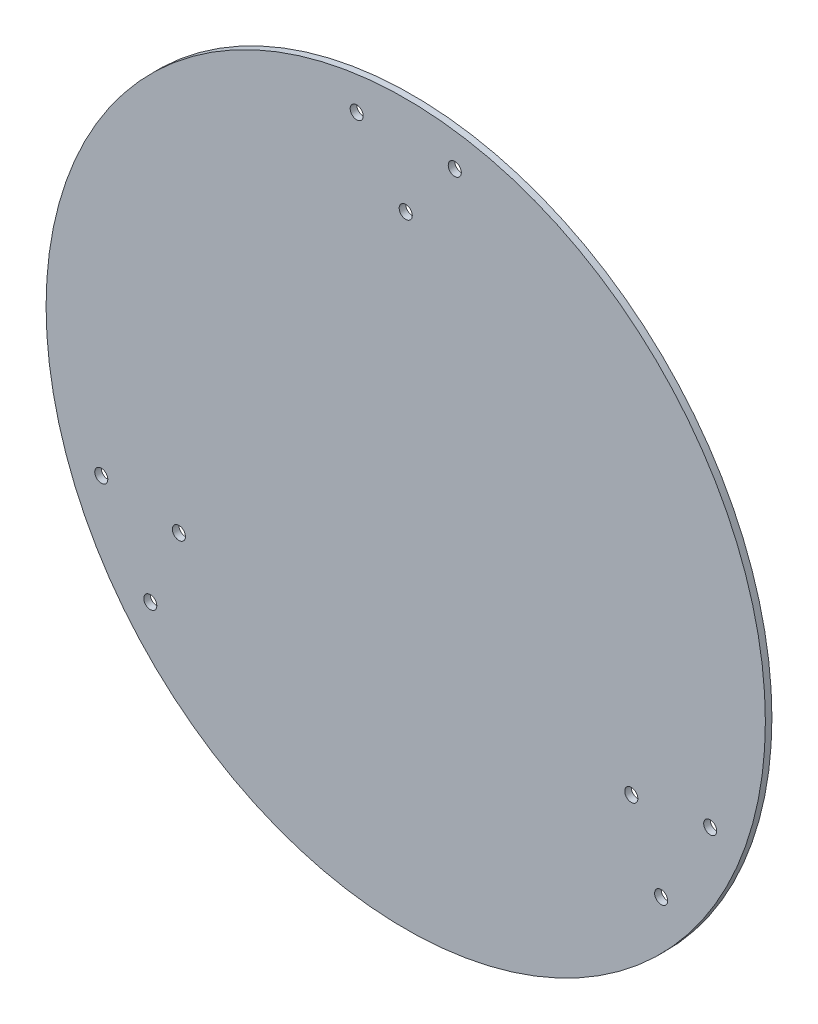
from build123d import *

# Parameters (mm, degrees)
ESQUISSE2_R             = 110
BOSS_EXTRU_1_DEPTH      = 2
ESQUISSE7_R             = 2
ESQUISSE7_R_2           = 1.991144914
ENL_V_MAT_EXTRU_7_DEPTH = 2


with BuildPart() as part:
    # Esquisse2 → Boss.-Extru.1 (new body)
    with BuildSketch(Plane.XY):
        Circle(ESQUISSE2_R)
    extrude(amount=BOSS_EXTRU_1_DEPTH)

    # Esquisse7 → Enlèv. mat.-Extru.7 (cut)
    with BuildSketch(Plane(origin=(0, 0, 0), x_dir=(-1, 0, 0), z_dir=(0, 0, -1))):
        with Locations((-15, 98.868599666)):
            Circle(ESQUISSE7_R)
        with Locations((15, 98.868599666)):
            Circle(ESQUISSE7_R_2)
        with Locations((69.377054927, -39.718437198)):
            Circle(ESQUISSE7_R)
        with Locations((93.122718948, -36.443918776)):
            Circle(ESQUISSE7_R)
        with Locations((78.122718948, -62.42468089)):
            Circle(ESQUISSE7_R_2)
        with Locations((-68.990680451, -39.941510605)):
            Circle(ESQUISSE7_R)
        with Locations((-78.122718948, -62.42468089)):
            Circle(ESQUISSE7_R)
        with Locations((-93.122718948, -36.443918776)):
            Circle(ESQUISSE7_R_2)
        with Locations((0, 80)):
            Circle(ESQUISSE7_R)
    extrude(amount=-ENL_V_MAT_EXTRU_7_DEPTH, mode=Mode.SUBTRACT)


solid = part.part
